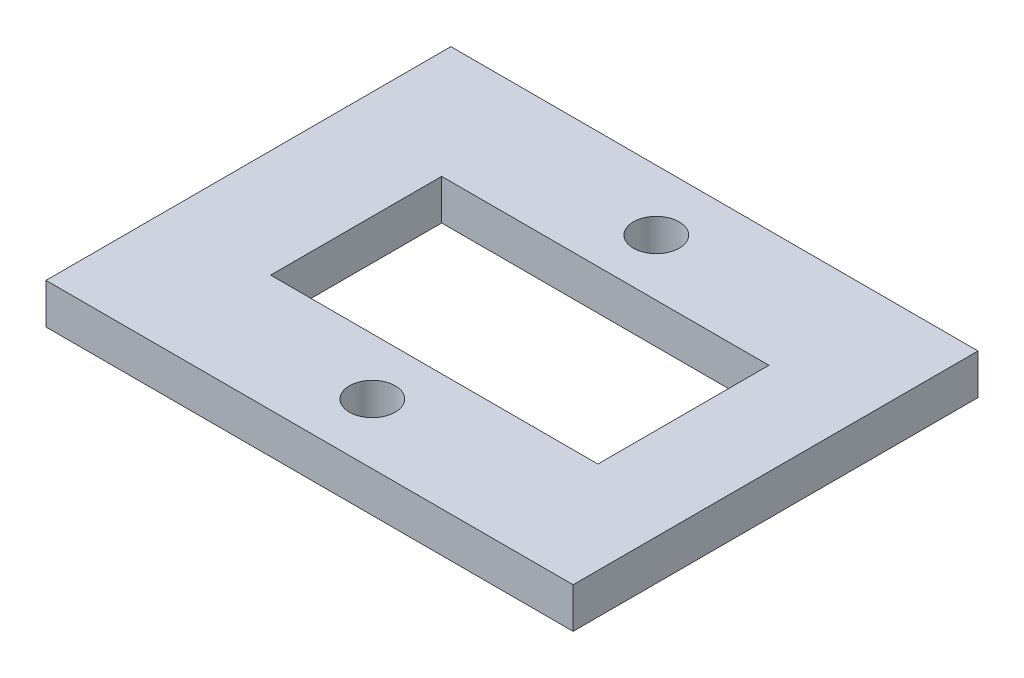
from build123d import *

# Parameters (mm, degrees)
SKETCH2_W           = 39.14123172
SKETCH2_H           = 30.06303
SKETCH2_R           = 1.7
SKETCH2_W_2         = 24.3
SKETCH2_H_2         = 12.7
BOSS_EXTRUDE1_DEPTH = 1.5


with BuildPart() as part:
    # Sketch2 → Boss-Extrude1 (new, symmetric)
    with BuildSketch(Plane(origin=(0, 0, 0), x_dir=(1, 0, 0), z_dir=(0, 1, 0))):
        with Locations((-1.058385778, 4.410566346)):
            Rectangle(SKETCH2_W, SKETCH2_H)
        with Locations(Location((-0.887769918, 14.954361346, 0), (0, 0, 270))):
            Circle(SKETCH2_R, mode=Mode.SUBTRACT)
        with Locations(Location((-0.887769918, -6.133228654, 0), (0, 0, 270))):
            Circle(SKETCH2_R, mode=Mode.SUBTRACT)
        with Locations((-0.479001638, 4.409051346)):
            Rectangle(SKETCH2_W_2, SKETCH2_H_2, mode=Mode.SUBTRACT)
    extrude(amount=BOSS_EXTRUDE1_DEPTH, both=True)


solid = part.part
